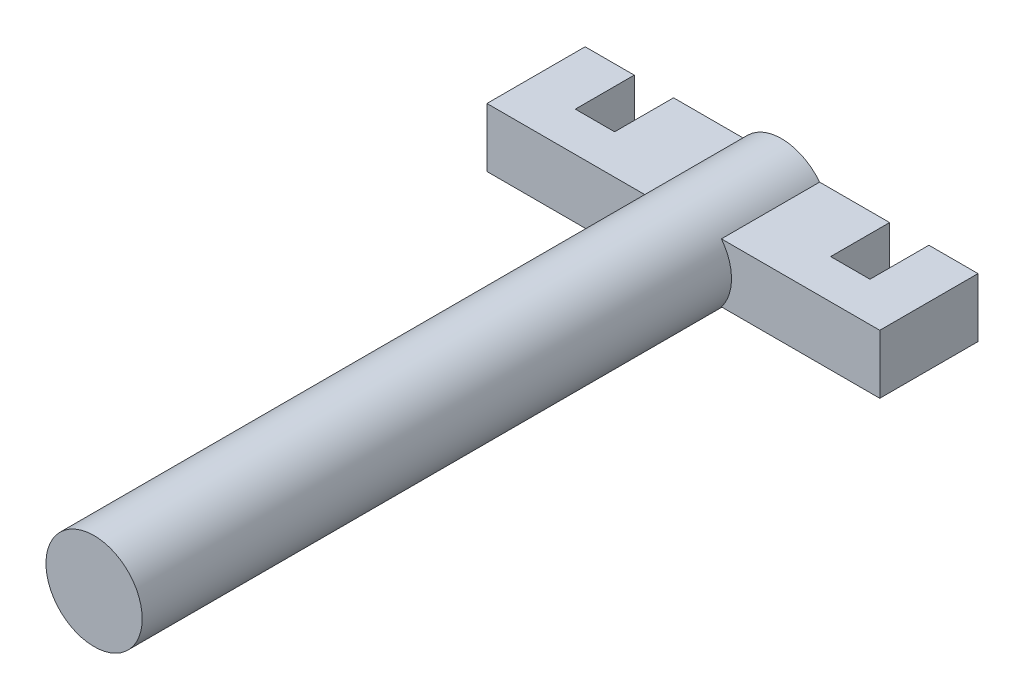
from build123d import *

# Parameters (mm, degrees)
SKETCH2_R           = 2.45
BOSS_EXTRUDE1_DEPTH = 35
SKETCH3_W           = 20
SKETCH3_H           = 3
BOSS_EXTRUDE2_DEPTH = 5
SKETCH4_W           = 2
SKETCH4_H           = 3
CUT_EXTRUDE1_DEPTH  = 3


with BuildPart() as part:
    # Sketch2 → Boss-Extrude1 (new body)
    with BuildSketch(Plane.XY):
        Circle(SKETCH2_R)
    extrude(amount=BOSS_EXTRUDE1_DEPTH)

    # Sketch3 → Boss-Extrude2 (add)
    with BuildSketch(Plane(origin=(0, 0, 0), x_dir=(-1, 0, 0), z_dir=(0, 0, -1))):
        Rectangle(SKETCH3_W, SKETCH3_H)
    extrude(amount=-BOSS_EXTRUDE2_DEPTH)

    # Sketch4 → Cut-Extrude1 (cut)
    with BuildSketch(Plane(origin=(0, 0, 0), x_dir=(-1, 0, 0), z_dir=(0, 0, -1))):
        with Locations((-6.5, 0)):
            Rectangle(SKETCH4_W, SKETCH4_H)
        with Locations((6.5, 0)):
            Rectangle(SKETCH4_W, SKETCH4_H)
    extrude(amount=-CUT_EXTRUDE1_DEPTH, mode=Mode.SUBTRACT)


solid = part.part
